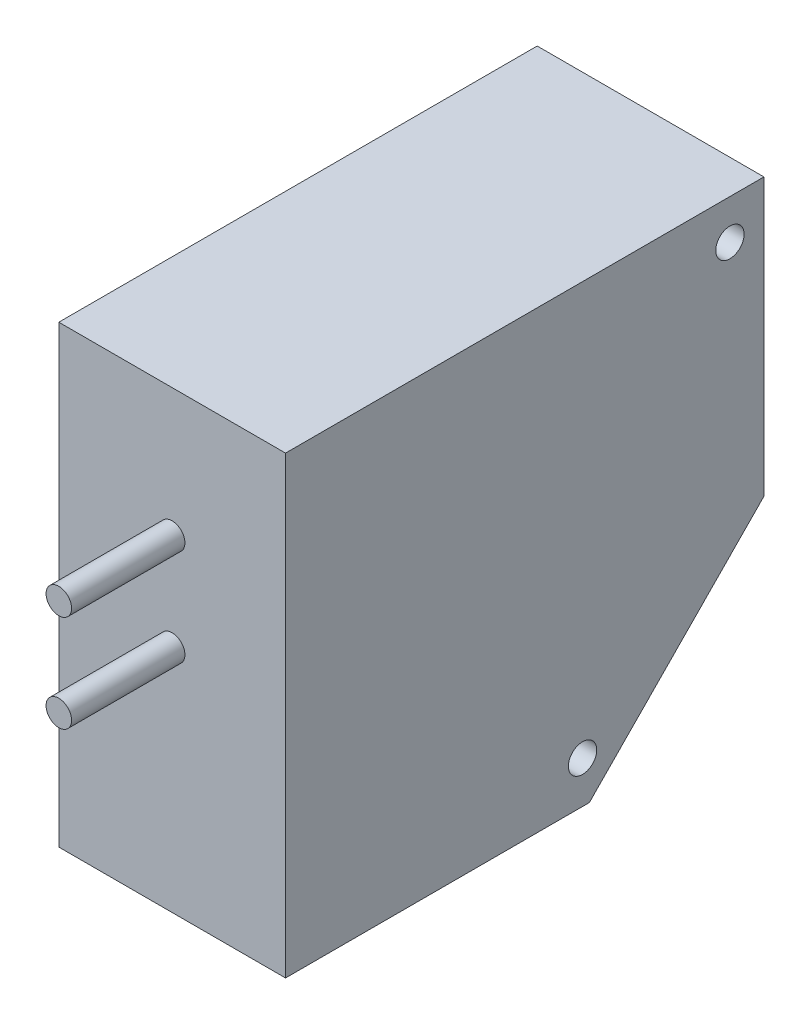
from build123d import *

# Parameters (mm, degrees)
BOSS_EXTRUDE1_DEPTH        = 20
F_2_5_2_5_DIAMETER_HOLE1_D = 2.5
F_2_5_2_5_DIAMETER_HOLE2_D = 2.5
SKETCH6_R                  = 1.125
BOSS_EXTRUDE2_DEPTH        = 10


with BuildPart() as part:
    # Sketch1 → Boss-Extrude1 (new body)
    with BuildSketch(Plane(origin=(0, 0, 0), x_dir=(0, 0, -1), z_dir=(1, 0, 0))):
        Polygon((5.7, -20.05), (21.1, -4.35), (21.1, 20.05), (-21.1, 20.05), (-21.1, -20.05), align=None)
    extrude(amount=BOSS_EXTRUDE1_DEPTH)

    # Ø2.5 (2.5) Diameter Hole1 (through all)
    with Locations(Plane(origin=(20, 0, 0), x_dir=(0, 0, -1), z_dir=(1, 0, 0))):
        with Locations((18.1, 16.55)):
            Hole(F_2_5_2_5_DIAMETER_HOLE1_D / 2)

    # Ø2.5 (2.5) Diameter Hole2 (through all)
    with Locations(Plane(origin=(20, 0, 0), x_dir=(0, 0, -1), z_dir=(1, 0, 0))):
        with Locations((5.1, -16.35)):
            Hole(F_2_5_2_5_DIAMETER_HOLE2_D / 2)

    # Sketch6 → Boss-Extrude2 (add)
    with BuildSketch(Plane.XY.offset(21.1)):
        with Locations(Location((10, 8.75, 0), (0, 0, 90))):
            Circle(SKETCH6_R)
        with Locations(Location((10, 0.2, 0), (0, 0, 90))):
            Circle(SKETCH6_R)
    extrude(amount=BOSS_EXTRUDE2_DEPTH)


solid = part.part
